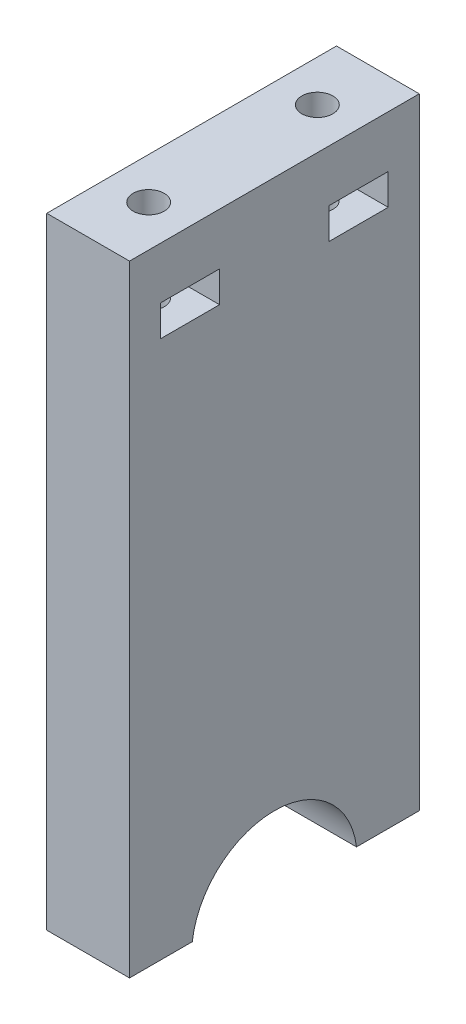
from build123d import *

# Parameters (mm, degrees)
SKETCH1_W           = 8
SKETCH1_H           = 28
BOSS_EXTRUDE2_DEPTH = 60
CUT_EXTRUDE2_DEPTH  = 65.353734654
SKETCH6_R           = 1.5
CUT_EXTRUDE3_DEPTH  = 25
SKETCH7_W           = 5.7
SKETCH7_H           = 3
CUT_EXTRUDE4_DEPTH  = 65.353734654
SKETCH8_R           = 1.5
CUT_EXTRUDE5_DEPTH  = 25


with BuildPart() as part:
    # Sketch1 → Boss-Extrude2 (new body)
    with BuildSketch(Plane(origin=(0, 0, 0), x_dir=(1, 0, 0), z_dir=(0, 1, 0))):
        with Locations((6, 7.849557522)):
            Rectangle(SKETCH1_W, SKETCH1_H)
    extrude(amount=BOSS_EXTRUDE2_DEPTH)

    # Sketch5 → Cut-Extrude2 (cut, through all)
    with BuildSketch(Plane(origin=(10, 0, 0), x_dir=(0, 0, -1), z_dir=(1, 0, 0))):
        with BuildLine():
            Line((-0.087696411, 0), (15.786811455, 0))
            ThreePointArc((15.786811455, 0), (7.849557522, 7), (-0.087696411, 0))
        make_face()
    extrude(amount=-CUT_EXTRUDE2_DEPTH, mode=Mode.SUBTRACT)

    # Sketch6 → Cut-Extrude3 (cut)
    with BuildSketch(Plane.XZ):
        with Locations(Location((6, -18.349557522, 0), (0, 0, 270))):
            Circle(SKETCH6_R)
        with Locations(Location((6, 2.650442478, 0), (0, 0, 270))):
            Circle(SKETCH6_R)
    extrude(amount=-CUT_EXTRUDE3_DEPTH, mode=Mode.SUBTRACT)

    # Sketch7 → Cut-Extrude4 (cut, through all)
    with BuildSketch(Plane.ZY.offset(-2)):
        with Locations((-15.999557522, 53.5)):
            Rectangle(SKETCH7_W, SKETCH7_H)
        with Locations((0.300442478, 53.5)):
            Rectangle(SKETCH7_W, SKETCH7_H)
    extrude(amount=-CUT_EXTRUDE4_DEPTH, mode=Mode.SUBTRACT)

    # Sketch8 → Cut-Extrude5 (cut)
    with BuildSketch(Plane(origin=(0, 60, 0), x_dir=(1, 0, 0), z_dir=(0, 1, 0))):
        with Locations(Location((6, 15.999557522, 0), (0, 0, 270))):
            Circle(SKETCH8_R)
        with Locations(Location((6, -0.300442478, 0), (0, 0, 270))):
            Circle(SKETCH8_R)
    extrude(amount=-CUT_EXTRUDE5_DEPTH, mode=Mode.SUBTRACT)


solid = part.part
